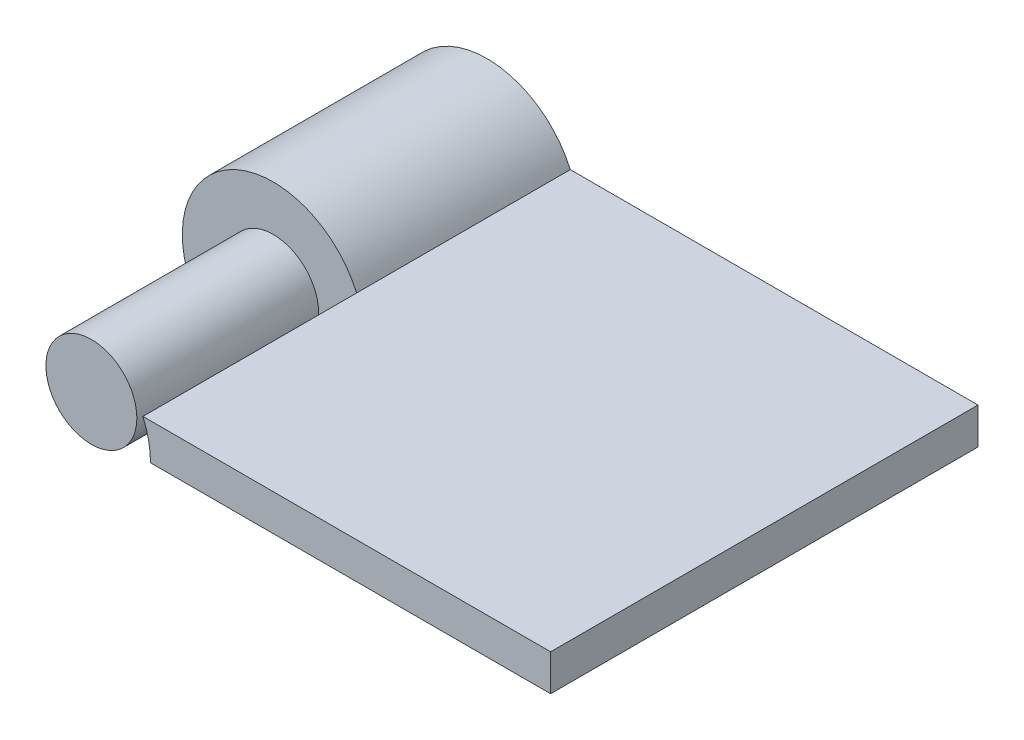
from build123d import *

# Parameters (mm, degrees)
SKETCH1_R           = 10
BOSS_EXTRUDE1_DEPTH = 23.5
BOSS_EXTRUDE2_START = 23.5
SKETCH1_3_R         = 5
BOSS_EXTRUDE2_DEPTH = 20
BOSS_EXTRUDE3_DEPTH = 47


with BuildPart() as part:
    # Sketch1 → Boss-Extrude1 (new body)
    with BuildSketch(Plane.XY):
        Circle(SKETCH1_R)
    extrude(amount=BOSS_EXTRUDE1_DEPTH)

    # Sketch1<3> → Boss-Extrude2 (add)
    with BuildSketch(Plane.XY.offset(BOSS_EXTRUDE2_START)):
        Circle(SKETCH1_3_R)
    extrude(amount=BOSS_EXTRUDE2_DEPTH)

    # Sketch1<4> → Boss-Extrude3 (add)
    with BuildSketch(Plane.XY):
        with BuildLine():
            ThreePointArc((9.16515139, 4), (9.789063129, 2.043096437), (10, 0))
            Line((10, 0), (37.504998297, 0))
            Line((37.504998297, 0), (54, 0))
            Line((54, 0), (54, 4))
            Line((54, 4), (9.16515139, 4))
        make_face()
    extrude(amount=BOSS_EXTRUDE3_DEPTH)


solid = part.part
